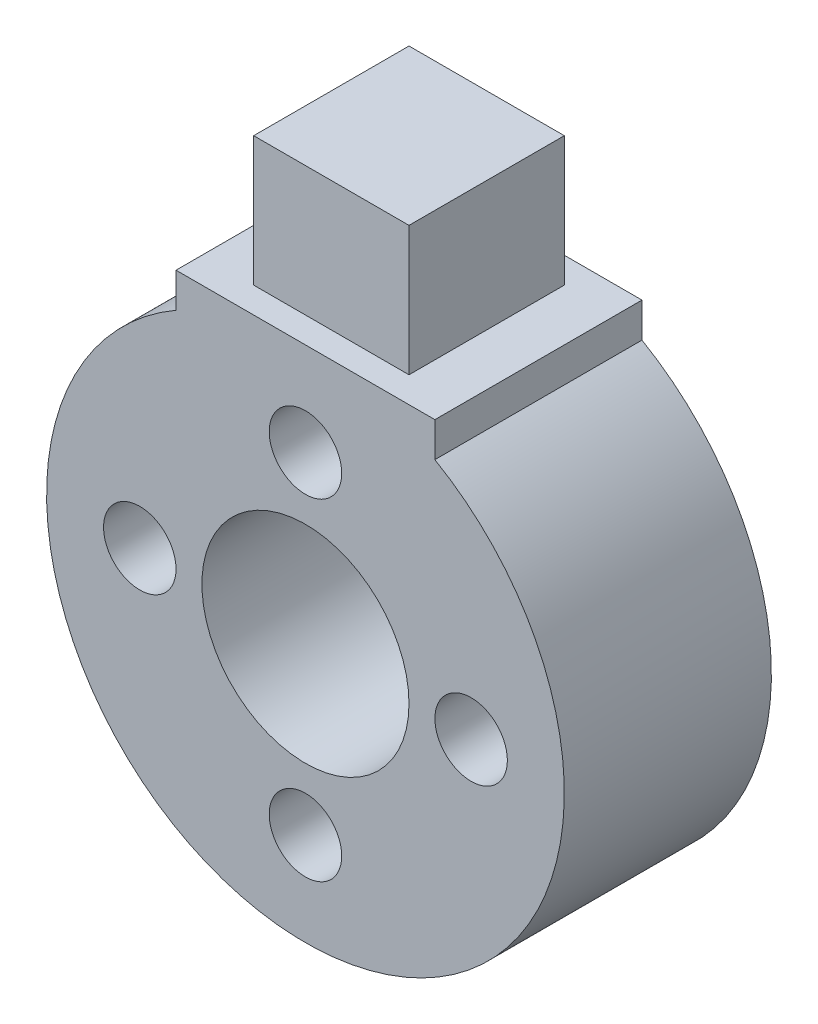
from build123d import *

# Parameters (mm, degrees)
SKETCH1_R           = 5.08
SKETCH1_R_2         = 1.778
BOSS_EXTRUDE1_DEPTH = 10.16
SKETCH2_W           = 7.62
SKETCH2_H           = 7.62
BOSS_EXTRUDE2_DEPTH = 6.35


with BuildPart() as part:
    # Sketch1 → Boss-Extrude1 (new body)
    with BuildSketch(Plane.XY):
        with BuildLine():
            Line((-6.35, 12.7), (-6.35, 10.998522628))
            ThreePointArc((-6.35, 10.998522628), (0, -12.7), (6.35, 10.998522628))
            Line((6.35, 10.998522628), (6.35, 12.7))
            Line((6.35, 12.7), (-6.35, 12.7))
        make_face()
        Circle(SKETCH1_R, mode=Mode.SUBTRACT)
        with Locations((0, 8.128)):
            Circle(SKETCH1_R_2, mode=Mode.SUBTRACT)
        with Locations((8.128, 0)):
            Circle(SKETCH1_R_2, mode=Mode.SUBTRACT)
        with Locations((0, -8.128)):
            Circle(SKETCH1_R_2, mode=Mode.SUBTRACT)
        with Locations((-8.128, 0)):
            Circle(SKETCH1_R_2, mode=Mode.SUBTRACT)
    extrude(amount=BOSS_EXTRUDE1_DEPTH)

    # Sketch2 → Boss-Extrude2 (add)
    with BuildSketch(Plane(origin=(0, 12.7, 0), x_dir=(1, 0, 0), z_dir=(0, 1, 0))):
        with Locations((0, -5.08)):
            Rectangle(SKETCH2_W, SKETCH2_H)
    extrude(amount=BOSS_EXTRUDE2_DEPTH)


solid = part.part
